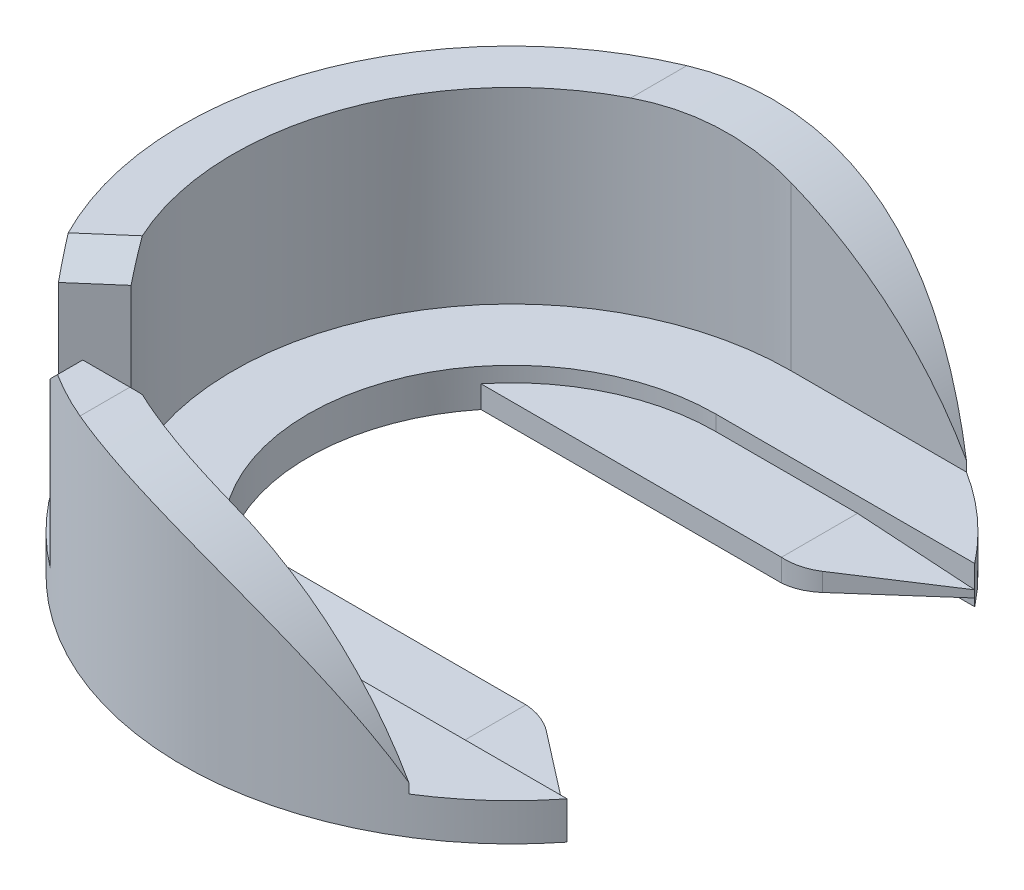
from build123d import *

# Parameters (mm, degrees)
BOSS_EXTRUDE1_DEPTH            = 4.4
BOSS_EXTRUDE2_START            = 4.4
BOSS_EXTRUDE2_DEPTH            = 40
BOSS_EXTRUDE3_START            = 4.4
BOSS_EXTRUDE3_DEPTH            = 3
CUT_EXTRUDE1_START             = -37
CUT_EXTRUDE1_DEPTH             = 37
CUT_EXTRUDE2_DEPTH             = 120.718001988
CUT_EXTRUDE2_DEPTH_BACK        = 120.718001988
FILLET1_R                      = 10
CUT_EXTRUDE3_REACH             = 121.718
CUT_EXTRUDE3_DIRECTION_2_REACH = 121.718
FILLET2_R                      = 1
CHAMFER1_SIZE                  = 5
CUT_EXTRUDE4_REACH             = 141.367
CUT_EXTRUDE4_END_RADIUS        = 65


with BuildPart() as part:
    # Sketch1 → Boss-Extrude1 (new body)
    with BuildSketch(Plane(origin=(0, 0, 0), x_dir=(1, 0, 0), z_dir=(0, 1, 0))):
        with BuildLine():
            Line((-31.320919527, 25.2), (31.320919527, 25.2))
            Line((31.320919527, 25.2), (51.0779796, 40.2))
            ThreePointArc((51.0779796, 40.2), (-65, 0), (51.0779796, -40.2))
            Line((51.0779796, -40.2), (31.320919527, -25.2))
            Line((31.320919527, -25.2), (-31.320919527, -25.2))
            ThreePointArc((-31.320919527, -25.2), (-40.2, 0), (-31.320919527, 25.2))
        make_face()
    extrude(amount=BOSS_EXTRUDE1_DEPTH)

    # Sketch1<3> → Boss-Extrude2 (add)
    with BuildSketch(Plane(origin=(0, 0, 0), x_dir=(1, 0, 0), z_dir=(0, 1, 0)).offset(BOSS_EXTRUDE2_START)):
        with BuildLine():
            ThreePointArc((0, -55), (-55, 0), (0, 55))
            Line((0, 55), (34.641016151, 55))
            ThreePointArc((34.641016151, 55), (-65, 0), (34.641016151, -55))
            Line((34.641016151, -55), (0, -55))
        make_face()
    extrude(amount=BOSS_EXTRUDE2_DEPTH)

    # Sketch1<4> → Boss-Extrude3 (add)
    with BuildSketch(Plane(origin=(0, 0, 0), x_dir=(1, 0, 0), z_dir=(0, 1, 0)).offset(BOSS_EXTRUDE3_START)):
        with BuildLine():
            ThreePointArc((-40.2, 0), (-37.915306704, 13.359248389), (-31.320919527, 25.2))
            ThreePointArc((-31.320919527, 25.2), (-17.363755354, 36.256585609), (0, 40.2))
            Line((0, 40.2), (37.536115942, 40.2))
            ThreePointArc((37.536115942, 40.2), (20.174241002, 51.166395222), (0, 55))
            ThreePointArc((0, 55), (-38.890872965, 38.890872965), (-55, 0))
            Line((-55, 0), (-40.2, 0))
        make_face()
        with BuildLine():
            ThreePointArc((-31.320919527, -25.2), (-37.915306704, -13.359248389), (-40.2, 0))
            Line((-40.2, 0), (-55, 0))
            ThreePointArc((-55, 0), (-38.890872965, -38.890872965), (0, -55))
            ThreePointArc((0, -55), (20.174241002, -51.166395222), (37.536115942, -40.2))
            Line((37.536115942, -40.2), (0, -40.2))
            ThreePointArc((0, -40.2), (-17.363755354, -36.256585609), (-31.320919527, -25.2))
        make_face()
        with BuildLine():
            ThreePointArc((37.536115942, -40.2), (20.174241002, -51.166395222), (0, -55))
            Line((0, -55), (34.641016151, -55))
            ThreePointArc((34.641016151, -55), (43.493638134, -48.304279747), (51.0779796, -40.2))
            Line((51.0779796, -40.2), (37.536115942, -40.2))
        make_face()
        with BuildLine():
            ThreePointArc((0, 55), (20.174241002, 51.166395222), (37.536115942, 40.2))
            Line((37.536115942, 40.2), (51.0779796, 40.2))
            ThreePointArc((51.0779796, 40.2), (43.493638134, 48.304279747), (34.641016151, 55))
            Line((34.641016151, 55), (0, 55))
        make_face()
    extrude(amount=BOSS_EXTRUDE3_DEPTH)

    # Sketch2 → Cut-Extrude1 (cut)
    with BuildSketch(Plane(origin=(0, 44.4, 0), x_dir=(1, 0, 0), z_dir=(0, 1, 0)).offset(CUT_EXTRUDE1_START)):
        with BuildLine():
            Line((-47.634201136, -27.495142883), (-55.300459871, -34.15931993))
            ThreePointArc((-55.300459871, -34.15931993), (-49.056122714, -42.643836884), (-41.523220262, -50.008221115))
            Line((-41.523220262, -50.008221115), (-33.856961527, -43.344044068))
            ThreePointArc((-33.856961527, -43.344044068), (-41.509026912, -36.083246594), (-47.634201136, -27.495142883))
        make_face()
        with BuildLine():
            Line((-33.856961527, -43.344044068), (-41.523220262, -50.008221115))
            Line((-41.523220262, -50.008221115), (-22.894930026, -50.008221115))
            ThreePointArc((-22.894930026, -50.008221115), (-28.570913752, -46.996839121), (-33.856961527, -43.344044068))
        make_face()
    extrude(amount=CUT_EXTRUDE1_DEPTH, mode=Mode.SUBTRACT)

    # Sketch3 → Cut-Extrude2 (cut, two sides: drawn at the far end of the back side and taken through both)
    with BuildSketch(Plane.XY.offset(-25.2).offset(-CUT_EXTRUDE2_DEPTH_BACK)):
        with BuildLine():
            Line((34.641016151, 44.4), (-25.358983849, 44.4))
            ThreePointArc((-25.358983849, 44.4), (9.372126125, 35.01047424), (34.641016151, 9.4))
            Line((34.641016151, 9.4), (34.641016151, 44.4))
        make_face()
    extrude(amount=CUT_EXTRUDE2_DEPTH + CUT_EXTRUDE2_DEPTH_BACK, mode=Mode.SUBTRACT)

    # Fillet1
    fillet1_edges = [part.edges().sort_by_distance(p)[0] for p in [
        (31.320919527, 2.2, -25.2),
        (31.320919527, 2.2, 25.2),
    ]]
    fillet(fillet1_edges, radius=FILLET1_R)

    # Cut-Extrude3: up to this face of the body (flat: up to its plane)
    cut_extrude3_end = Plane(part.part.faces().sort_by_distance((25.5389898, 5.9, -40.2))[0])
    # Sketch4 → Cut-Extrude3 (cut, up to the picked face)
    with BuildSketch(Plane.XY.offset(-25.2), mode=Mode.PRIVATE) as cut_extrude3_sk1:
        Polygon((51.0779796, 4.4), (27.954908691, 4.4), (51.0779796, 2.9), align=None)
    cut_extrude3_tool1 = split(extrude(cut_extrude3_sk1.sketch, amount=-CUT_EXTRUDE3_REACH, mode=Mode.PRIVATE), bisect_by=cut_extrude3_end, keep=Keep.BOTH, mode=Mode.PRIVATE)
    # Sketch4 → Cut-Extrude3 (cut, up to the picked face)
    with BuildSketch(Plane.XY.offset(-25.2), mode=Mode.PRIVATE) as cut_extrude3_sk2:
        Polygon((51.0779796, 0), (51.0779796, 1.5), (27.954908691, 0), align=None)
    cut_extrude3_tool2 = split(extrude(cut_extrude3_sk2.sketch, amount=-CUT_EXTRUDE3_REACH, mode=Mode.PRIVATE), bisect_by=cut_extrude3_end, keep=Keep.BOTH, mode=Mode.PRIVATE)
    add(cut_extrude3_tool1.solids().sort_by(Axis((43.370289, 3.9, -25.2), (0, 0, -1)))[0], mode=Mode.SUBTRACT)
    add(cut_extrude3_tool2.solids().sort_by(Axis((43.370289, 0.5, -25.2), (0, 0, -1)))[0], mode=Mode.SUBTRACT)

    # Cut-Extrude3 direction 2: up to this face of the body (flat: up to its plane)
    cut_extrude3_direction_2_end = Plane(part.part.faces().sort_by_distance((25.5389898, 5.9, 40.2))[0])
    # Sketch4 → Cut-Extrude3 direction 2 (cut, up to the picked face)
    with BuildSketch(Plane.XY.offset(-25.2), mode=Mode.PRIVATE) as cut_extrude3_direction_2_sk1:
        Polygon((51.0779796, 4.4), (27.954908691, 4.4), (51.0779796, 2.9), align=None)
    cut_extrude3_direction_2_tool1 = split(extrude(cut_extrude3_direction_2_sk1.sketch, amount=CUT_EXTRUDE3_DIRECTION_2_REACH, mode=Mode.PRIVATE), bisect_by=cut_extrude3_direction_2_end, keep=Keep.BOTH, mode=Mode.PRIVATE)
    # Sketch4 → Cut-Extrude3 direction 2 (cut, up to the picked face)
    with BuildSketch(Plane.XY.offset(-25.2), mode=Mode.PRIVATE) as cut_extrude3_direction_2_sk2:
        Polygon((51.0779796, 0), (51.0779796, 1.5), (27.954908691, 0), align=None)
    cut_extrude3_direction_2_tool2 = split(extrude(cut_extrude3_direction_2_sk2.sketch, amount=CUT_EXTRUDE3_DIRECTION_2_REACH, mode=Mode.PRIVATE), bisect_by=cut_extrude3_direction_2_end, keep=Keep.BOTH, mode=Mode.PRIVATE)
    add(cut_extrude3_direction_2_tool1.solids().sort_by(Axis((43.370289, 3.9, -25.2), (0, 0, 1)))[0], mode=Mode.SUBTRACT)
    add(cut_extrude3_direction_2_tool2.solids().sort_by(Axis((43.370289, 0.5, -25.2), (0, 0, 1)))[0], mode=Mode.SUBTRACT)

    # Fillet2
    fillet2_edges = [part.edges().sort_by_distance(p)[0] for p in [
        (-41.523220262, 25.9, 50.008221115),
    ]]
    fillet(fillet2_edges, radius=FILLET2_R)

    # Chamfer1
    chamfer1_edges = [part.edges().sort_by_distance(p)[0] for p in [
        (-51.467330503, 44.4, 30.827231407),
    ]]
    chamfer(chamfer1_edges, length=CHAMFER1_SIZE)

    # Cut-Extrude4: up to this cylinder (the profile starts inside it)
    cut_extrude4_end = Plane(origin=(0, 42.733333, 0), z_dir=(0, -1, 0)) * Cylinder(CUT_EXTRUDE4_END_RADIUS, 413.734, mode=Mode.PRIVATE)
    # Sketch5 → Cut-Extrude4 (cut, up to the surface)
    with BuildSketch(Plane(origin=(0, 0, 50.008221115), x_dir=(-1, 0, 0), z_dir=(0, 0, -1)), mode=Mode.PRIVATE) as cut_extrude4_sk1:
        Polygon((34.654383693, 44.4), (39.654383693, 39.4), (39.654383693, 44.4), align=None)
    cut_extrude4_tool1 = extrude(cut_extrude4_sk1.sketch, amount=-CUT_EXTRUDE4_REACH, mode=Mode.PRIVATE) & cut_extrude4_end
    add(cut_extrude4_tool1.solids().sort_by_distance((-37.987717, 42.733333, 50.008221))[0], mode=Mode.SUBTRACT)


solid = part.part
